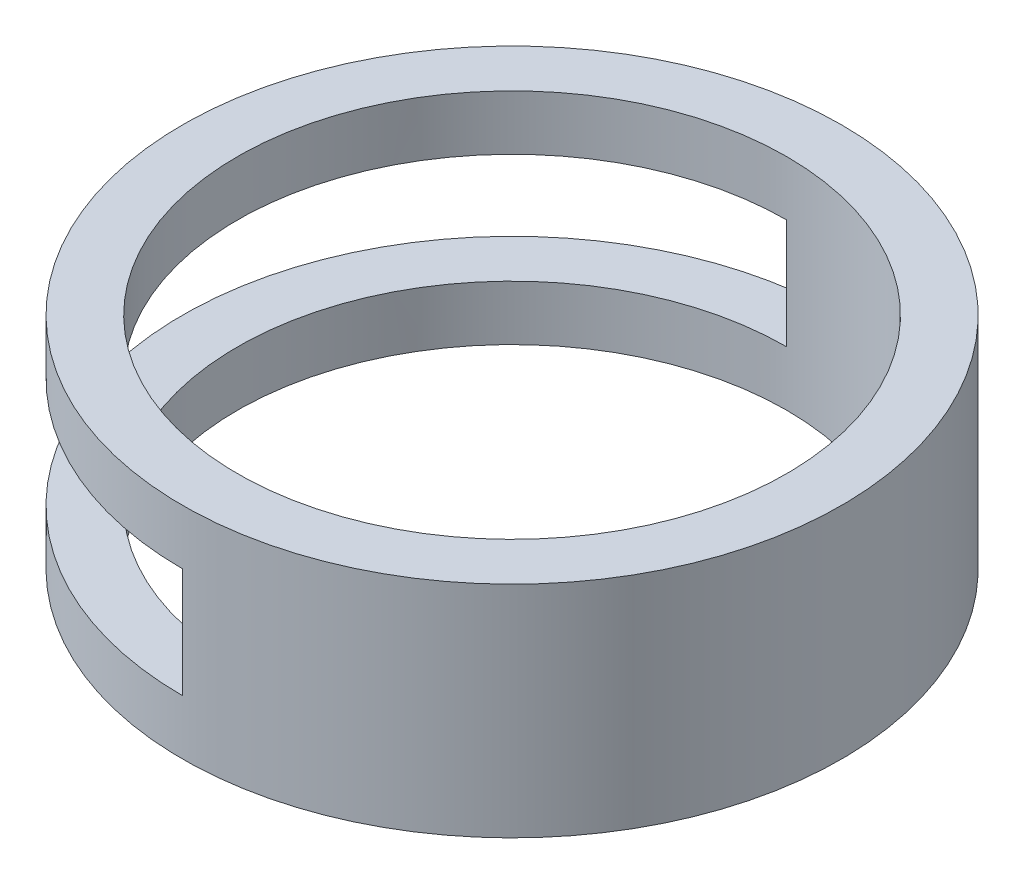
from build123d import *

# Parameters (mm, degrees)
SKETCH1_W          = 5
SKETCH1_H          = 20
SKETCH1_12_W       = 5
SKETCH1_12_H       = 10
CUT_REVOLVE5_ANGLE = 180


with BuildPart() as part:
    # Sketch1 → Revolve5 (revolve)
    with BuildSketch(Plane.XY):
        with Locations((-2.5, -10)):
            Rectangle(SKETCH1_W, SKETCH1_H)
    revolve(axis=Axis((25, -980.065573431, 0), (0, 1, 0)))

    # Sketch1<12> → Cut-Revolve5 (revolve, symmetric, cut)
    with BuildSketch(Plane.XY) as cut_revolve5_sk:
        with Locations((-2.5, -10)):
            Rectangle(SKETCH1_12_W, SKETCH1_12_H)
    revolve(axis=Axis((25, -980.065573431, 0), (0, 1, 0)), revolution_arc=CUT_REVOLVE5_ANGLE / 2, mode=Mode.SUBTRACT)
    revolve(cut_revolve5_sk.sketch, axis=Axis((25, -980.065573431, 0), (0, -1, 0)), revolution_arc=CUT_REVOLVE5_ANGLE / 2, mode=Mode.SUBTRACT)


solid = part.part
